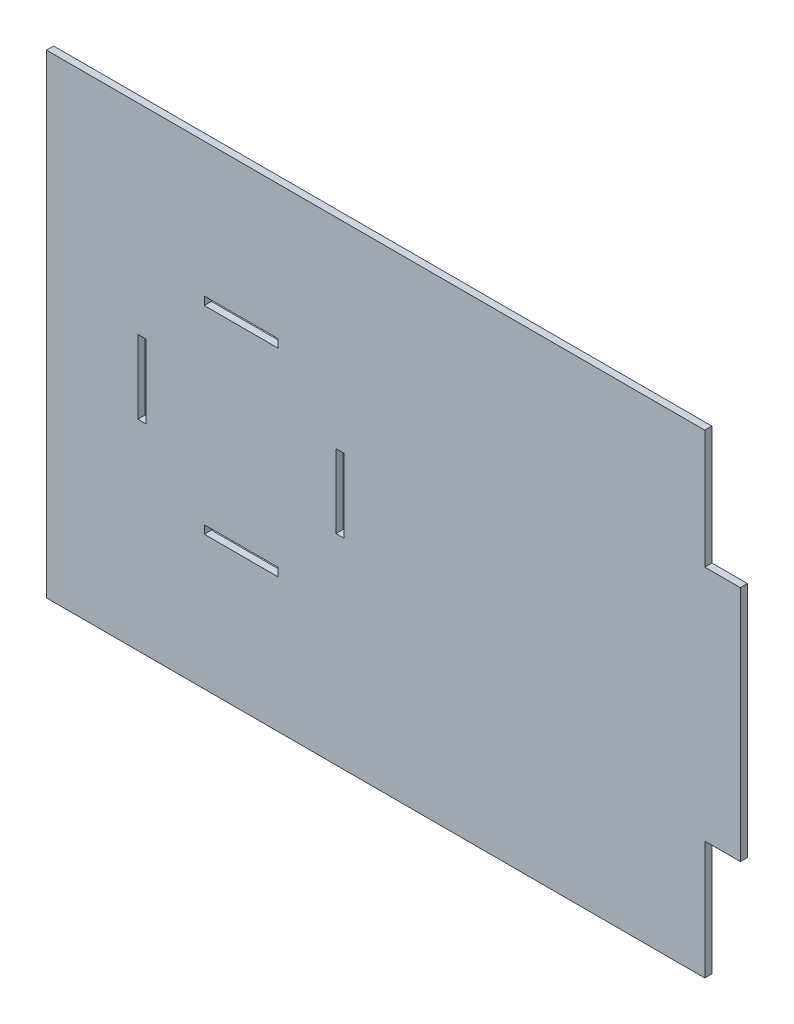
from build123d import *

# Parameters (mm, degrees)
ESBO_O1_W                = 555
ESBO_O1_H                = 200
RESSALTO_EXTRUS_O1_DEPTH = 3
ESBO_O2_W                = 3.5
ESBO_O2_H                = 31
ESBO_O2_W_2              = 31
ESBO_O2_H_2              = 3.5
CORTE_EXTRUS_O1_DEPTH    = 295.983474113
CORTE_EXTRUS_O2_DEPTH    = 295.983474113


with BuildPart() as part:
    # Esboço1 → Ressalto-extrusão1 (new body)
    with BuildSketch(Plane.XY):
        Rectangle(ESBO_O1_W, ESBO_O1_H)
    extrude(amount=RESSALTO_EXTRUS_O1_DEPTH)

    # Esboço2 → Corte-extrusão1 (cut, through all)
    with BuildSketch(Plane.XY.offset(3)):
        with Locations((237.25, 0)):
            Rectangle(ESBO_O2_W, ESBO_O2_H)
        with Locations((-153.75, 0)):
            Rectangle(ESBO_O2_W, ESBO_O2_H)
        with Locations((-237.25, 0)):
            Rectangle(ESBO_O2_W, ESBO_O2_H)
        with Locations((-195.5, 41.75)):
            Rectangle(ESBO_O2_W_2, ESBO_O2_H_2)
        with Locations((-195.5, -41.75)):
            Rectangle(ESBO_O2_W_2, ESBO_O2_H_2)
        with Locations((153.75, 0)):
            Rectangle(ESBO_O2_W, ESBO_O2_H)
        with Locations((195.5, -41.75)):
            Rectangle(ESBO_O2_W_2, ESBO_O2_H_2)
        with Locations((195.5, 41.75)):
            Rectangle(ESBO_O2_W_2, ESBO_O2_H_2)
    extrude(amount=-CORTE_EXTRUS_O1_DEPTH, mode=Mode.SUBTRACT)

    # Esboço3 → Corte-extrusão2 (cut, through all)
    with BuildSketch(Plane.XY.offset(3)):
        Polygon((0, 100), (0, 50), (15, 50), (15, -50), (0, -50), (0, -100), (277.5, -100), (277.5, 100), align=None)
    extrude(amount=-CORTE_EXTRUS_O2_DEPTH, mode=Mode.SUBTRACT)


solid = part.part
